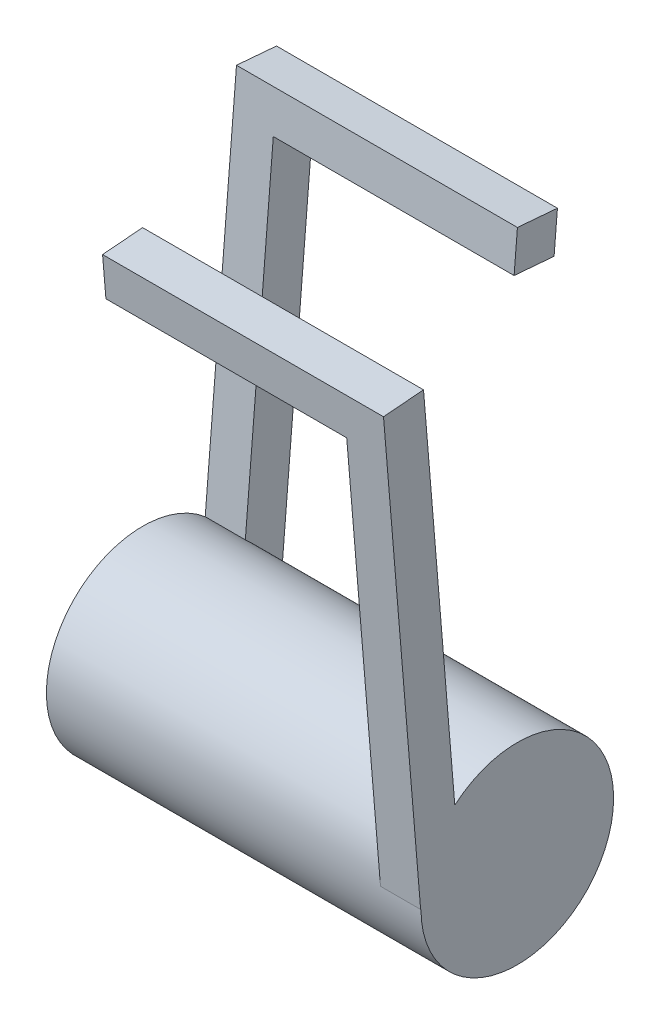
from build123d import *

# Parameters (mm, degrees)
SKETCH1_R           = 3.6
BOSS_EXTRUDE1_DEPTH = 14
BOSS_EXTRUDE2_DEPTH = 1.5
BOSS_EXTRUDE3_DEPTH = 9
CIRPATTERN1_COUNT   = 2


with BuildPart() as part:
    # Sketch1 → Boss-Extrude1 (new body)
    with BuildSketch(Plane(origin=(0, 0, 0), x_dir=(0, 0, -1), z_dir=(1, 0, 0))):
        Circle(SKETCH1_R)
    extrude(amount=BOSS_EXTRUDE1_DEPTH)

    # Sketch2 → Boss-Extrude2 (add)
    with BuildSketch(Plane.ZY):
        Polygon((-5, 16.642259954), (-3.505186232, 16.766886588), (-2.117676372, 0.124626634), (-3.61249014, 0), align=None)
    boss_extrude2 = extrude(amount=-BOSS_EXTRUDE2_DEPTH)

    # Sketch4 → Boss-Extrude3 (add)
    with BuildSketch(Plane(origin=(1.5, 0, 0), x_dir=(0, 0, -1), z_dir=(1, 0, 0))):
        Polygon((5, 16.642259954), (3.505186232, 16.766886588), (3.380559598, 15.27207282), (4.875373366, 15.147446186), align=None)
    boss_extrude3 = extrude(amount=BOSS_EXTRUDE3_DEPTH)

    # CirPattern1: Boss-Extrude2, Boss-Extrude3 ×2 about axis
    cirpattern1_axis = Axis((7, 17.785230918, 0), (0, -1, 0))
    add([boss_extrude2.rotate(cirpattern1_axis, i * 360 / CIRPATTERN1_COUNT) for i in range(1, CIRPATTERN1_COUNT)])
    add([boss_extrude3.rotate(cirpattern1_axis, i * 360 / CIRPATTERN1_COUNT) for i in range(1, CIRPATTERN1_COUNT)])


solid = part.part
